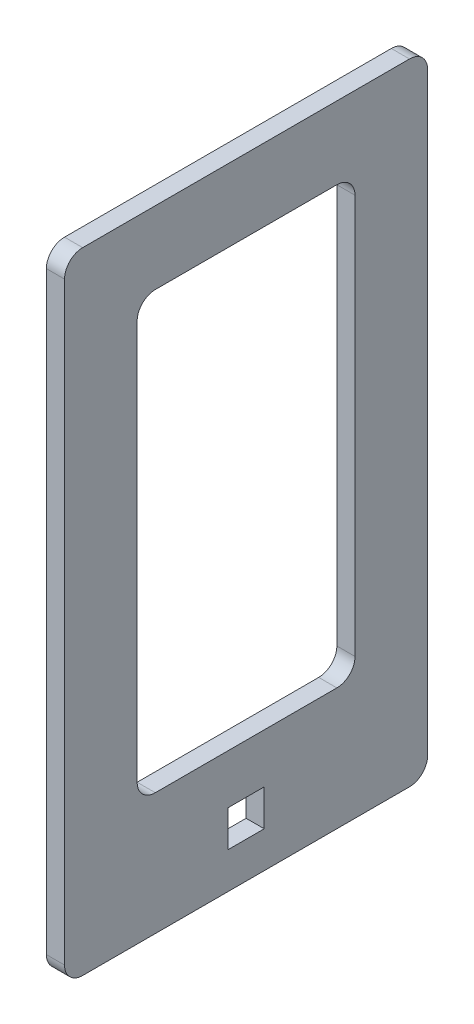
from build123d import *

# Parameters (mm, degrees)
BOSS_EXTRUDE2_DEPTH = 6.35
CUT_EXTRUDE1_REACH  = 129.376
SKETCH4_W           = 12.7
SKETCH4_H           = 12.7


with BuildPart() as part:
    # Sketch3 → Boss-Extrude2 (new body)
    with BuildSketch(Plane(origin=(0, 0, 0), x_dir=(0, 0, -1), z_dir=(1, 0, 0))):
        with BuildLine():
            Line((-57.15, -110.236), (57.15, -110.236))
            ThreePointArc((57.15, -110.236), (61.640128061, -108.376128061), (63.5, -103.886))
            Line((63.5, -103.886), (63.5, 103.886))
            ThreePointArc((63.5, 103.886), (61.640128061, 108.376128061), (57.15, 110.236))
            Line((57.15, 110.236), (-57.15, 110.236))
            ThreePointArc((-57.15, 110.236), (-61.640128061, 108.376128061), (-63.5, 103.886))
            Line((-63.5, 103.886), (-63.5, -103.886))
            ThreePointArc((-63.5, -103.886), (-61.640128061, -108.376128061), (-57.15, -110.236))
        make_face()
        with BuildLine():
            Line((-31.75, -67.564), (31.75, -67.564))
            ThreePointArc((31.75, -67.564), (36.240128061, -65.704128061), (38.1, -61.214))
            Line((38.1, -61.214), (38.1, 78.486))
            ThreePointArc((38.1, 78.486), (36.240128061, 82.976128061), (31.75, 84.836))
            Line((31.75, 84.836), (-31.75, 84.836))
            ThreePointArc((-31.75, 84.836), (-36.240128061, 82.976128061), (-38.1, 78.486))
            Line((-38.1, 78.486), (-38.1, -61.214))
            ThreePointArc((-38.1, -61.214), (-36.240128061, -65.704128061), (-31.75, -67.564))
        make_face(mode=Mode.SUBTRACT)
    extrude(amount=BOSS_EXTRUDE2_DEPTH)

    # Sketch4 → Cut-Extrude1 (cut, up to next)
    with BuildSketch(Plane(origin=(6.35, 0, 0), x_dir=(0, 0, -1), z_dir=(1, 0, 0)), mode=Mode.PRIVATE) as cut_extrude1_sk1:
        with Locations((0, -91.186)):
            Rectangle(SKETCH4_W, SKETCH4_H)
    cut_extrude1_tool1 = extrude(cut_extrude1_sk1.sketch, amount=-CUT_EXTRUDE1_REACH, mode=Mode.PRIVATE) & part.part
    add(cut_extrude1_tool1.solids().sort_by_distance((6.35, -91.186, 0))[0], mode=Mode.SUBTRACT)


solid = part.part
